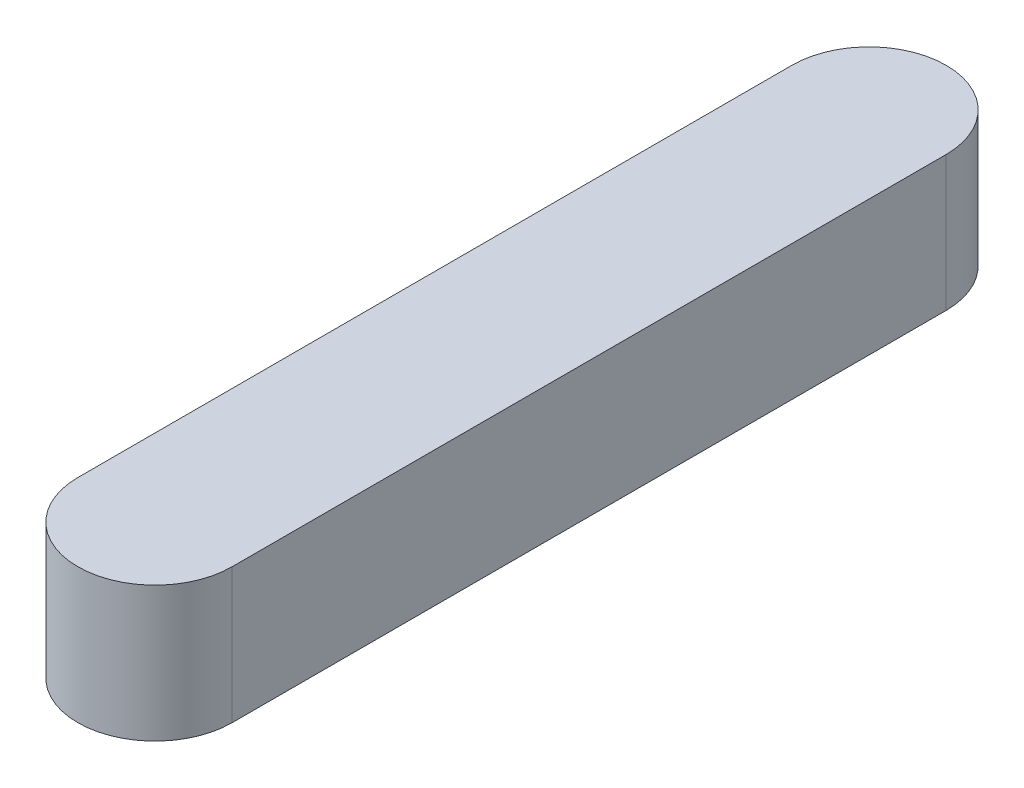
from build123d import *

# Parameters (mm, degrees)
VYSUNOUT1_DEPTH = 3.5


with BuildPart() as part:
    # Skica1 → Vysunout1 (new, symmetric)
    with BuildSketch(Plane(origin=(0, 0, 0), x_dir=(1, 0, 0), z_dir=(0, 1, 0))):
        with BuildLine():
            Line((-4, 18.5), (-4, -18.5))
            ThreePointArc((-4, -18.5), (0, -22.5), (4, -18.5))
            Line((4, -18.5), (4, 18.5))
            ThreePointArc((4, 18.5), (0, 22.5), (-4, 18.5))
        make_face()
    extrude(amount=VYSUNOUT1_DEPTH, both=True)


solid = part.part
